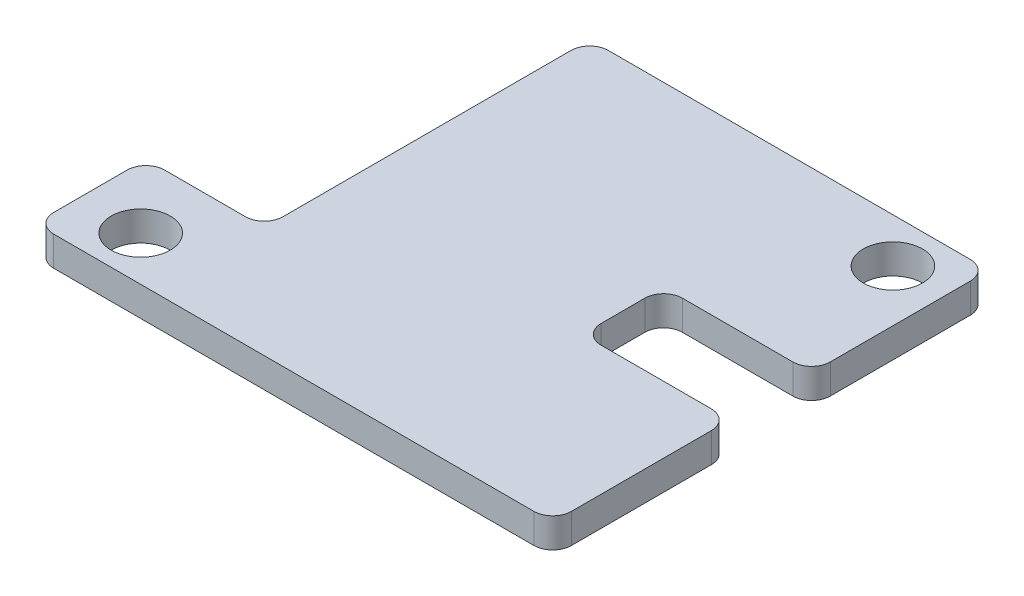
from build123d import *

# Parameters (mm, degrees)
CROQUIS1_R              = 2
SALIENTE_EXTRUIR1_DEPTH = 2
REDONDEO5_R             = 1.27


with BuildPart() as part:
    # Croquis1 → Saliente-Extruir1 (new body)
    with BuildSketch(Plane(origin=(0, 0, 0), x_dir=(1, 0, 0), z_dir=(0, 1, 0))):
        Polygon((0, 0), (35, 0), (35, 12), (25, 12), (25, 17.5), (35, 17.5), (35, 29.5), (8, 29.5), (8, 7.5), (0, 7.5), align=None)
        with Locations(Location((4.15, 3, 0), (0, 0, 270))):
            Circle(CROQUIS1_R, mode=Mode.SUBTRACT)
        with Locations(Location((31.5, 26.5, 0), (0, 0, 270))):
            Circle(CROQUIS1_R, mode=Mode.SUBTRACT)
    extrude(amount=SALIENTE_EXTRUIR1_DEPTH)

    # Redondeo5
    redondeo5_edges = [part.edges().sort_by_distance(p)[0] for p in [
        (0, 1, -7.5),
        (8, 1, -7.5),
        (8, 1, -29.5),
        (35, 1, -29.5),
        (35, 1, -17.5),
        (25, 1, -17.5),
        (25, 1, -12),
        (35, 1, -12),
        (35, 1, 0),
        (0, 1, 0),
    ]]
    fillet(redondeo5_edges, radius=REDONDEO5_R)


solid = part.part
